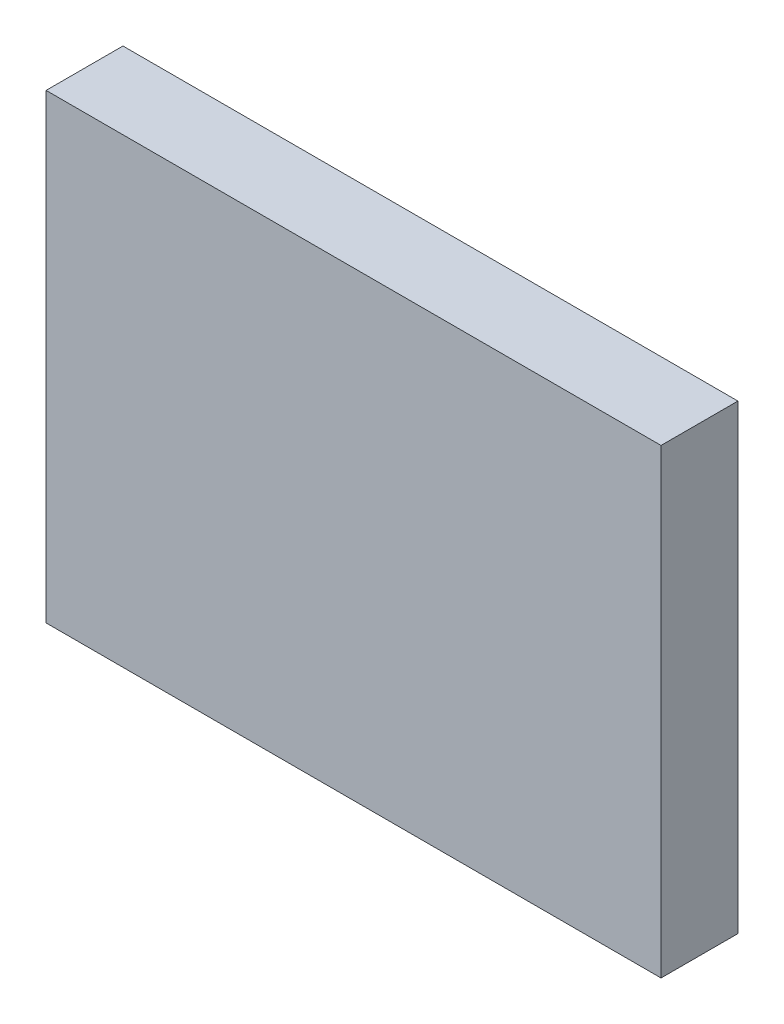
from build123d import *

# Parameters (mm, degrees)
SKETCH1_W           = 15.24
SKETCH1_H           = 20.32
BOSS_EXTRUDE1_DEPTH = 2.54


with BuildPart() as part:
    # Sketch1 → Boss-Extrude1 (new body)
    with BuildSketch(Plane(origin=(0, 0, 0), x_dir=(0, 1, 0), z_dir=(0, 0, 1))):
        Rectangle(SKETCH1_W, SKETCH1_H)
    extrude(amount=BOSS_EXTRUDE1_DEPTH)


solid = part.part
